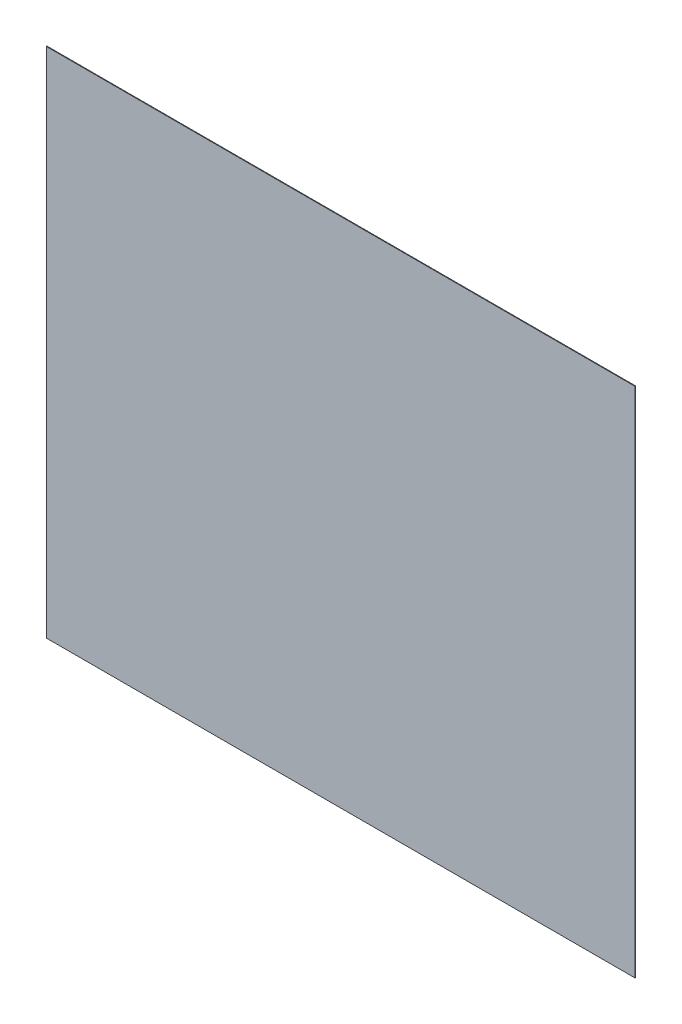
from build123d import *

# Parameters (mm, degrees)
SKETCH1_W           = 909.152642605
SKETCH1_H           = 791.14
BOSS_EXTRUDE1_DEPTH = 1


with BuildPart() as part:
    # Sketch1 → Boss-Extrude1 (new body)
    with BuildSketch(Plane.XY):
        with Locations((295.423678698, 395.57)):
            Rectangle(SKETCH1_W, SKETCH1_H)
    extrude(amount=BOSS_EXTRUDE1_DEPTH)


solid = part.part
